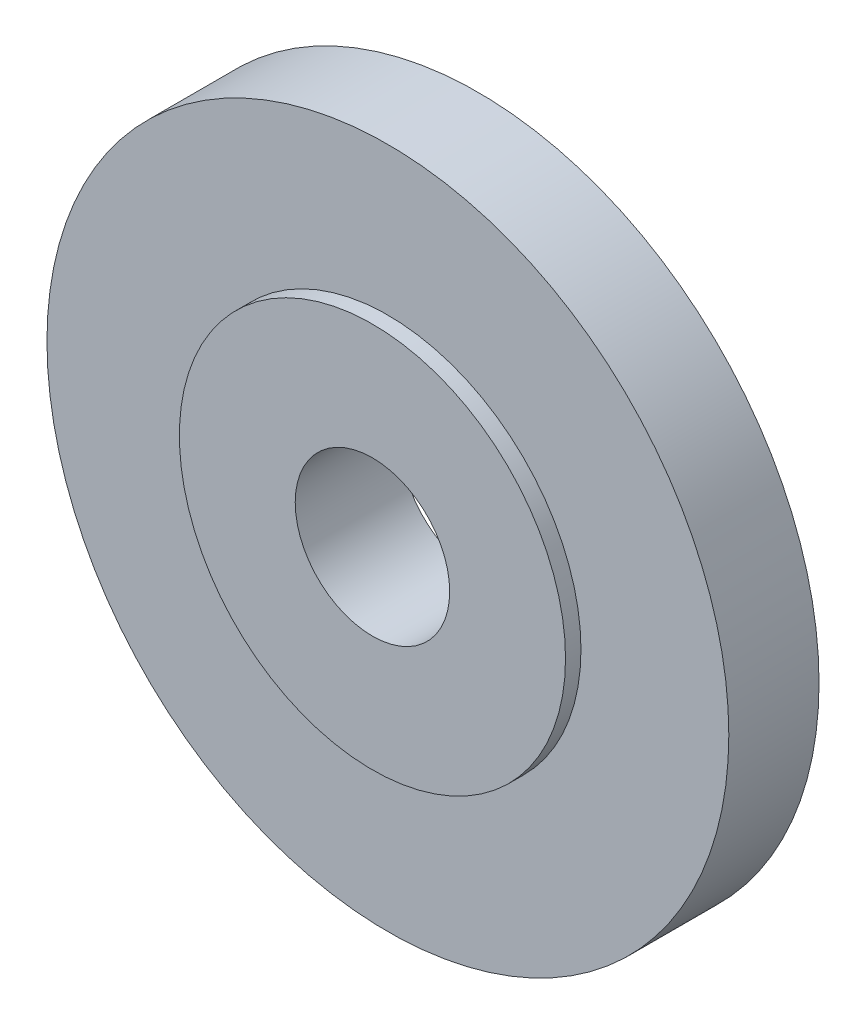
from build123d import *
from build123d.topology import SkipClean

# Parameters (mm, degrees)
SKETCH1_R           = 125
SKETCH1_R_2         = 50
BOSS_EXTRUDE1_DEPTH = 10
BOSS_EXTRUDE2_START = 58.41
SKETCH2_R           = 220.72
SKETCH2_R_2         = 50
BOSS_EXTRUDE2_DEPTH = 58.41


with BuildPart() as part:
    # Sketch1 → Boss-Extrude1 (new body)
    with BuildSketch(Plane.XY):
        Circle(SKETCH1_R)
        Circle(SKETCH1_R_2, mode=Mode.SUBTRACT)
    extrude(amount=BOSS_EXTRUDE1_DEPTH)

    # Sketch2 → Boss-Extrude2 (add)
    with SkipClean():  # the faces are left unmerged after this step: merging them gives an invalid solid
        with BuildSketch(Plane(origin=(0, 0, 0), x_dir=(-1, 0, 0), z_dir=(0, 0, -1)).offset(BOSS_EXTRUDE2_START)):
            Circle(SKETCH2_R)
            Circle(SKETCH2_R_2, mode=Mode.SUBTRACT)
        extrude(amount=-BOSS_EXTRUDE2_DEPTH)


solid = part.part
